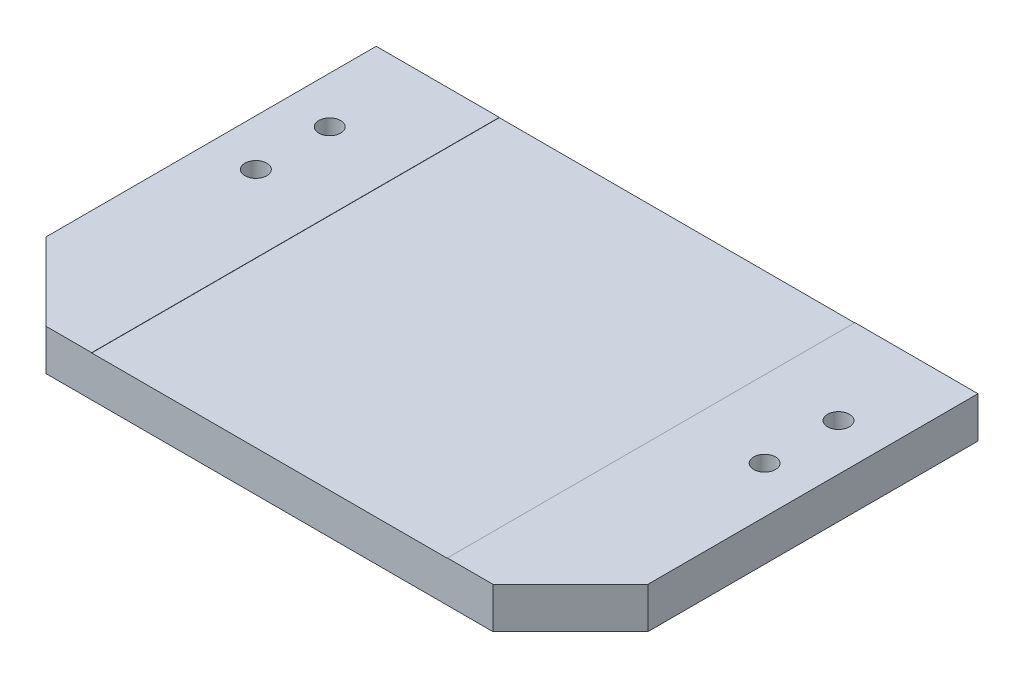
from build123d import *

# Parameters (mm, degrees)
ESQUISSE1_R             = 0.4
BOSS_EXTRU_1_DEPTH      = 1.5
ESQUISSE2_W             = 13
ESQUISSE2_H             = 14.9
ENL_V_MAT_EXTRU_1_DEPTH = 0.01


with BuildPart() as part:
    # Esquisse1 → Boss.-Extru.1 (new body)
    with BuildSketch(Plane(origin=(0, 0, 0), x_dir=(1, 0, 0), z_dir=(0, 1, 0))):
        Polygon((-11, 7.45), (11, 7.45), (11, -4.621572875), (8.171572875, -7.45), (-8.171572875, -7.45), (-11, -4.621572875), align=None)
        with Locations(Location((-9.3, 1.35, 0), (0, 0, 270))):
            Circle(ESQUISSE1_R, mode=Mode.SUBTRACT)
        with Locations(Location((-9.3, 4.05, 0), (0, 0, 270))):
            Circle(ESQUISSE1_R, mode=Mode.SUBTRACT)
        with Locations(Location((9.3, 1.35, 0), (0, 0, 270))):
            Circle(ESQUISSE1_R, mode=Mode.SUBTRACT)
        with Locations(Location((9.3, 4.05, 0), (0, 0, 270))):
            Circle(ESQUISSE1_R, mode=Mode.SUBTRACT)
    extrude(amount=BOSS_EXTRU_1_DEPTH)

    # Esquisse2 → Enlèv. mat.-Extru.1 (cut)
    with BuildSketch(Plane(origin=(0, 1.5, 0), x_dir=(1, 0, 0), z_dir=(0, 1, 0))):
        Rectangle(ESQUISSE2_W, ESQUISSE2_H)
    extrude(amount=-ENL_V_MAT_EXTRU_1_DEPTH, mode=Mode.SUBTRACT)


solid = part.part
